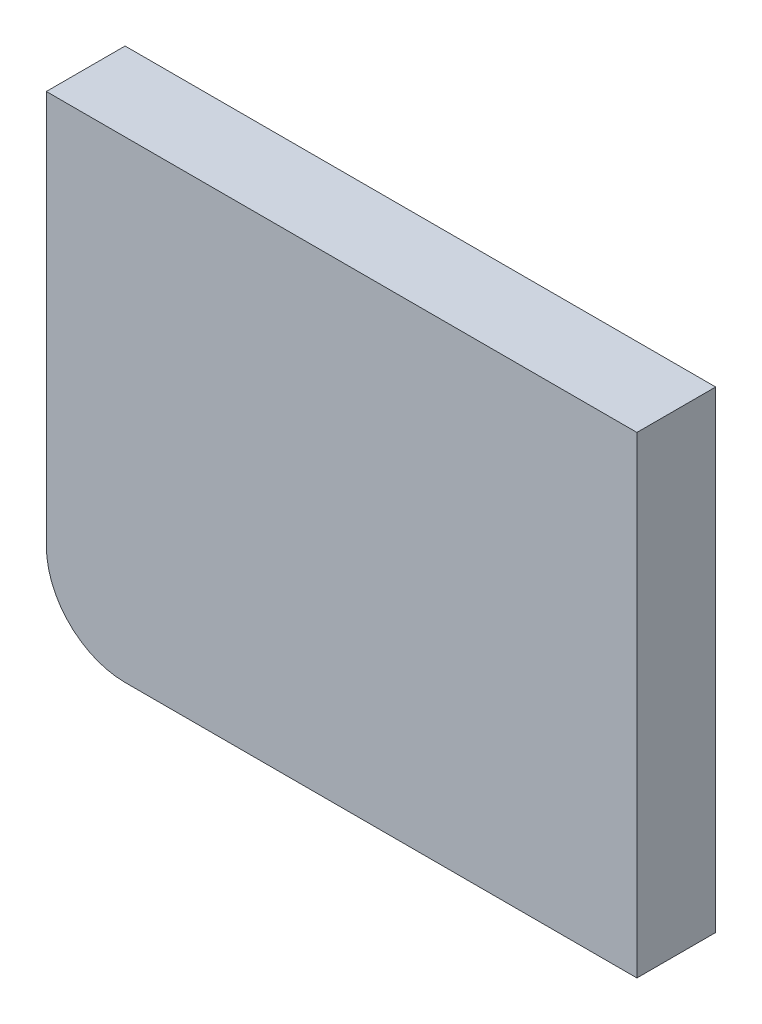
from build123d import *

# Parameters (mm, degrees)
BOSS_EXTRUDE1_DEPTH = 2


with BuildPart() as part:
    # Sketch1 → Boss-Extrude1 (new body)
    with BuildSketch(Plane.XY):
        with BuildLine():
            Line((-37.821244, 0.214456948), (-37.821244, 0))
            Line((-37.821244, 0), (-37.821244, -6))
            ThreePointArc((-37.821244, -6), (-37.235457562, -7.414213562), (-35.821244, -8))
            Line((-35.821244, -8), (-22.821244, -8))
            Line((-22.821244, -8), (-22.821244, 4))
            Line((-22.821244, 4), (-37.821244, 4))
            Line((-37.821244, 4), (-37.821244, 1))
            Line((-37.821244, 1), (-37.821244, 0.587709258))
            Line((-37.821244, 0.587709258), (-37.821244, 0.214456948))
        make_face()
    extrude(amount=BOSS_EXTRUDE1_DEPTH)


solid = part.part
